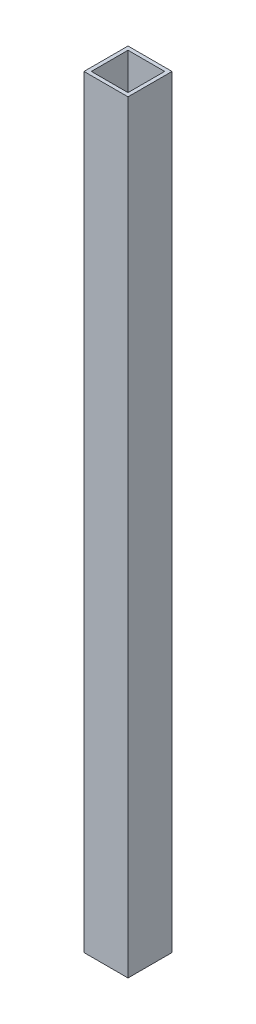
from build123d import *

# Parameters (mm, degrees)
SKETCH1_W           = 19.05
SKETCH1_H           = 19.05
SKETCH1_W_2         = 15.875
SKETCH1_H_2         = 15.875
BOSS_EXTRUDE1_DEPTH = 330.2


with BuildPart() as part:
    # Sketch1 → Boss-Extrude1 (new body)
    with BuildSketch(Plane(origin=(0, 0, 0), x_dir=(1, 0, 0), z_dir=(0, 1, 0))):
        with Locations((9.525, 9.525)):
            Rectangle(SKETCH1_W, SKETCH1_H)
        with Locations((9.525, 9.525)):
            Rectangle(SKETCH1_W_2, SKETCH1_H_2, mode=Mode.SUBTRACT)
    extrude(amount=BOSS_EXTRUDE1_DEPTH)


solid = part.part
